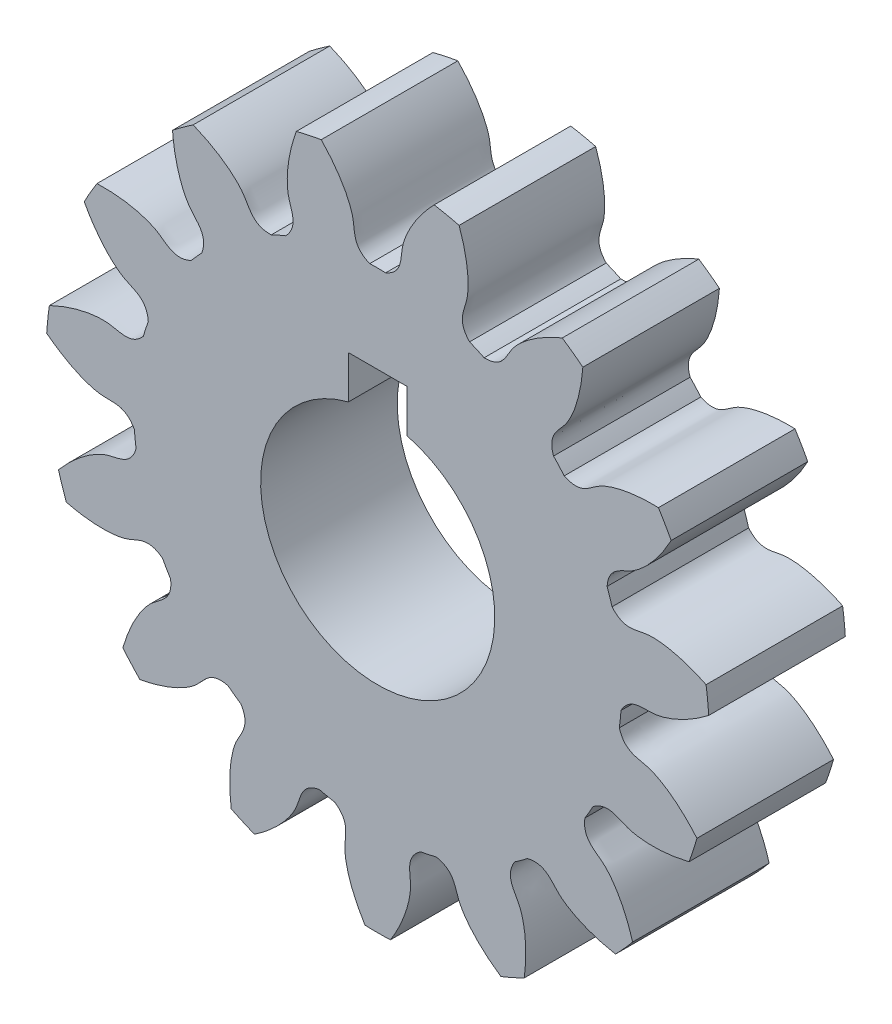
from build123d import *

# Parameters (mm, degrees)
SKETCH_1_R               = 17
EXTRUDE_1_DEPTH          = 7
CUT_EXTRUDE_1_DEPTH      = 26.039968051
PATTERN_CIRCULAR_1_COUNT = 15
CUT_EXTRUDE_2_DEPTH      = 10


with BuildPart() as part:
    # 草图1 → 凸台-拉伸1 (new body)
    with BuildSketch(Plane.XY):
        Circle(SKETCH_1_R)
    extrude(amount=EXTRUDE_1_DEPTH)

    # 草图2 → 切除-拉伸1 (cut, through all)
    with BuildSketch(Plane.XY):
        with BuildLine():
            ThreePointArc((0.408570082, 12.493321035), (0, 12.5), (-0.408570082, 12.493321035))
            add(Edge.make_bspline(
                [(-0.408570082, 12.493321035), (-1.314426117, 12.868820457), (-1.144226268, 13.572658845), (-1.302520973, 14.21700753), (-1.314866358, 14.263316593), (-1.329697695, 14.314787647), (-1.347220475, 14.371338609), (-1.367644802, 14.432879951), (-1.391176061, 14.499316195), (-1.418017606, 14.570545533), (-1.448369717, 14.646460034), (-1.482429702, 14.72694568), (-1.520391649, 14.811882453), (-1.562446298, 14.90114442), (-1.608780868, 14.994599817), (-1.659578902, 15.092111141), (-1.715020121, 15.193535247), (-1.77528026, 15.298723442), (-1.84053093, 15.407521596), (-1.910939461, 15.519770239), (-1.986668766, 15.635304677), (-2.067877193, 15.753955106), (-2.154718392, 15.875546727), (-2.247341174, 15.999899865), (-2.345889381, 16.1268301), (-2.450501754, 16.256148389), (-2.56131181, 16.387661197), (-2.678447713, 16.521170635), (-2.802032159, 16.656474594), (-2.932182257, 16.793366884), (-3.069009412, 16.931637384), (-3.212619223, 17.071072181), (-3.36311137, 17.21145372), (-3.520579511, 17.352560961), (-3.68511119, 17.494169528), (-3.856787733, 17.636051869), (-4.035684163, 17.777977411), (-4.22186911, 17.919712728), (-4.415404727, 18.0610217), (-4.616346612, 18.201665683), (-4.82474373, 18.341403675), (-5.040638346, 18.479992484), (-5.264065953, 18.617186906), (-5.495055218, 18.752739894), (-5.733627883, 18.88640274), (-6.065171324, 19.063537407), (-6.320303827, 19.190067932), (-6.493676778, 19.271856413)],
                knots=[0, 0, 0, 0, 0.202473101, 0.206978902, 0.212085478, 0.217792827, 0.224100949, 0.231009845, 0.238519514, 0.246629958, 0.255341174, 0.264653164, 0.274565928, 0.285079465, 0.296193776, 0.307908861, 0.320224719, 0.33314135, 0.346658755, 0.360776934, 0.375495886, 0.390815612, 0.406736111, 0.423257384, 0.440379431, 0.458102251, 0.476425844, 0.495350211, 0.514875352, 0.535001266, 0.555727954, 0.577055415, 0.59898365, 0.621512658, 0.64464244, 0.668372996, 0.692704325, 0.717636428, 0.743169304, 0.769302954, 0.796037377, 0.823372574, 0.851308544, 0.879845288, 0.908982806, 0.938721097, 1, 1, 1, 1], degree=3))
            ThreePointArc((-6.493676778, 19.271856413), (0, 20.336476777), (6.493676778, 19.271856413))
            add(Edge.make_bspline(
                [(0.408570082, 12.493321035), (1.314426117, 12.868820457), (1.144226268, 13.572658845), (1.302520973, 14.21700753), (1.314866358, 14.263316593), (1.329697695, 14.314787647), (1.347220475, 14.371338609), (1.367644802, 14.432879951), (1.391176061, 14.499316195), (1.418017606, 14.570545533), (1.448369717, 14.646460034), (1.482429702, 14.72694568), (1.520391649, 14.811882453), (1.562446298, 14.90114442), (1.608780868, 14.994599817), (1.659578902, 15.092111141), (1.715020121, 15.193535247), (1.77528026, 15.298723442), (1.84053093, 15.407521596), (1.910939461, 15.519770239), (1.986668766, 15.635304677), (2.067877193, 15.753955106), (2.154718392, 15.875546727), (2.247341174, 15.999899865), (2.345889381, 16.1268301), (2.450501754, 16.256148389), (2.56131181, 16.387661197), (2.678447713, 16.521170635), (2.802032159, 16.656474594), (2.932182257, 16.793366884), (3.069009412, 16.931637384), (3.212619223, 17.071072181), (3.36311137, 17.21145372), (3.520579511, 17.352560961), (3.68511119, 17.494169528), (3.856787733, 17.636051869), (4.035684163, 17.777977411), (4.22186911, 17.919712728), (4.415404727, 18.0610217), (4.616346612, 18.201665683), (4.82474373, 18.341403675), (5.040638346, 18.479992484), (5.264065953, 18.617186906), (5.495055218, 18.752739894), (5.733627883, 18.88640274), (6.065171324, 19.063537407), (6.320303827, 19.190067932), (6.493676778, 19.271856413)],
                knots=[0, 0, 0, 0, 0.202473101, 0.206978902, 0.212085478, 0.217792827, 0.224100949, 0.231009845, 0.238519514, 0.246629958, 0.255341174, 0.264653164, 0.274565928, 0.285079465, 0.296193776, 0.307908861, 0.320224719, 0.33314135, 0.346658755, 0.360776934, 0.375495886, 0.390815612, 0.406736111, 0.423257384, 0.440379431, 0.458102251, 0.476425844, 0.495350211, 0.514875352, 0.535001266, 0.555727954, 0.577055415, 0.59898365, 0.621512658, 0.64464244, 0.668372996, 0.692704325, 0.717636428, 0.743169304, 0.769302954, 0.796037377, 0.823372574, 0.851308544, 0.879845288, 0.908982806, 0.938721097, 1, 1, 1, 1], degree=3))
        make_face()
    cut_extrude_1 = extrude(amount=CUT_EXTRUDE_1_DEPTH, mode=Mode.SUBTRACT)

    # 阵列(圆周)1: 切除-拉伸1 ×15 about axis
    pattern_circular_1_axis = Axis((0, 0, -0.5), (0, 0, 1))
    for i in range(1, PATTERN_CIRCULAR_1_COUNT):
        add(cut_extrude_1.rotate(pattern_circular_1_axis, i * 360 / PATTERN_CIRCULAR_1_COUNT), mode=Mode.SUBTRACT)

    # 草图4 → 切除-拉伸2 (cut)
    with BuildSketch(Plane.XY.offset(7)):
        with BuildLine():
            Line((-1.5, 5.809475019), (-1.5, 8))
            Line((-1.5, 8), (1.5, 8))
            Line((1.5, 8), (1.5, 5.809475019))
            ThreePointArc((1.5, 5.809475019), (0, -6), (-1.5, 5.809475019))
        make_face()
    extrude(amount=-CUT_EXTRUDE_2_DEPTH, mode=Mode.SUBTRACT)


solid = part.part
